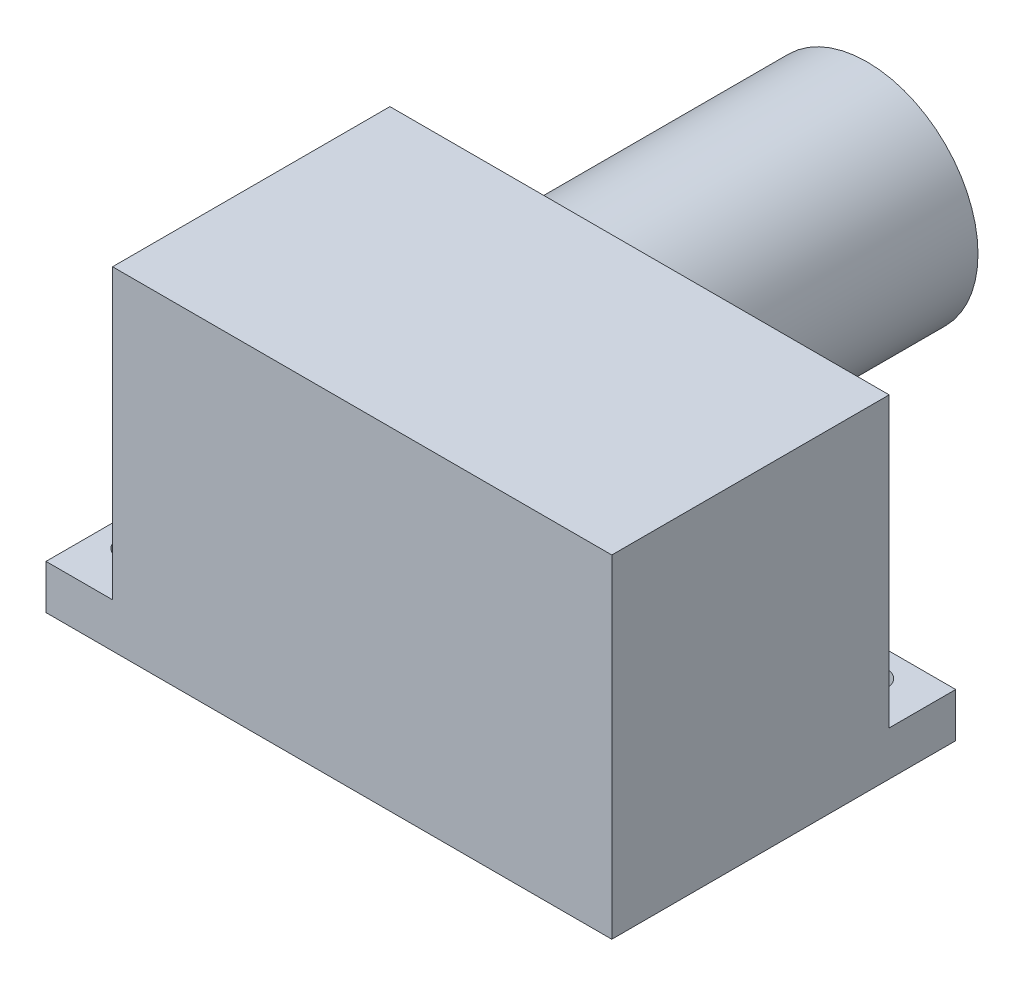
from build123d import *

# Parameters (mm, degrees)
ESQUISSE1_W             = 45
ESQUISSE1_H             = 30
BOSS_EXTRU_1_DEPTH      = 25
ESQUISSE2_R             = 10
BOSS_EXTRU_2_DEPTH      = 30
ESQUISSE3_W             = 10
ESQUISSE3_H             = 4
BOSS_EXTRU_3_DEPTH      = 6
ESQUISSE4_R             = 1.5
ENL_V_MAT_EXTRU_1_DEPTH = 6
ESQUISSE6_W             = 10
ESQUISSE6_H             = 4
BOSS_EXTRU_4_DEPTH      = 6
ESQUISSE7_R             = 1.5
ENL_V_MAT_EXTRU_2_DEPTH = 6


with BuildPart() as part:
    # Esquisse1 → Boss.-Extru.1 (new body)
    with BuildSketch(Plane.XY):
        Rectangle(ESQUISSE1_W, ESQUISSE1_H)
    extrude(amount=BOSS_EXTRU_1_DEPTH)

    # Esquisse2 → Boss.-Extru.2 (add)
    with BuildSketch(Plane(origin=(0, 0, 0), x_dir=(-1, 0, 0), z_dir=(0, 0, -1))):
        with Locations((9.492124495, 0)):
            Circle(ESQUISSE2_R)
    extrude(amount=BOSS_EXTRU_2_DEPTH)

    # Esquisse3 → Boss.-Extru.3 (add)
    with BuildSketch(Plane.ZY.offset(22.5)):
        with Locations((20, -13)):
            Rectangle(ESQUISSE3_W, ESQUISSE3_H)
    extrude(amount=BOSS_EXTRU_3_DEPTH)

    # Esquisse4 → Enlèv. mat.-Extru.1 (cut)
    with BuildSketch(Plane(origin=(0, -11, 0), x_dir=(1, 0, 0), z_dir=(0, 1, 0))):
        with Locations(Location((-25.529560032, -20, 0), (0, 0, 270))):
            Circle(ESQUISSE4_R)
    extrude(amount=-ENL_V_MAT_EXTRU_1_DEPTH, mode=Mode.SUBTRACT)

    # Esquisse6 → Boss.-Extru.4 (add)
    with BuildSketch(Plane(origin=(0, 0, 0), x_dir=(-1, 0, 0), z_dir=(0, 0, -1))):
        with Locations((-17.5, -13)):
            Rectangle(ESQUISSE6_W, ESQUISSE6_H)
    extrude(amount=BOSS_EXTRU_4_DEPTH)

    # Esquisse7 → Enlèv. mat.-Extru.2 (cut)
    with BuildSketch(Plane(origin=(0, -11, 0), x_dir=(1, 0, 0), z_dir=(0, 1, 0))):
        with Locations(Location((17.789413963, 3, 0), (0, 0, 270))):
            Circle(ESQUISSE7_R)
    extrude(amount=-ENL_V_MAT_EXTRU_2_DEPTH, mode=Mode.SUBTRACT)


solid = part.part
